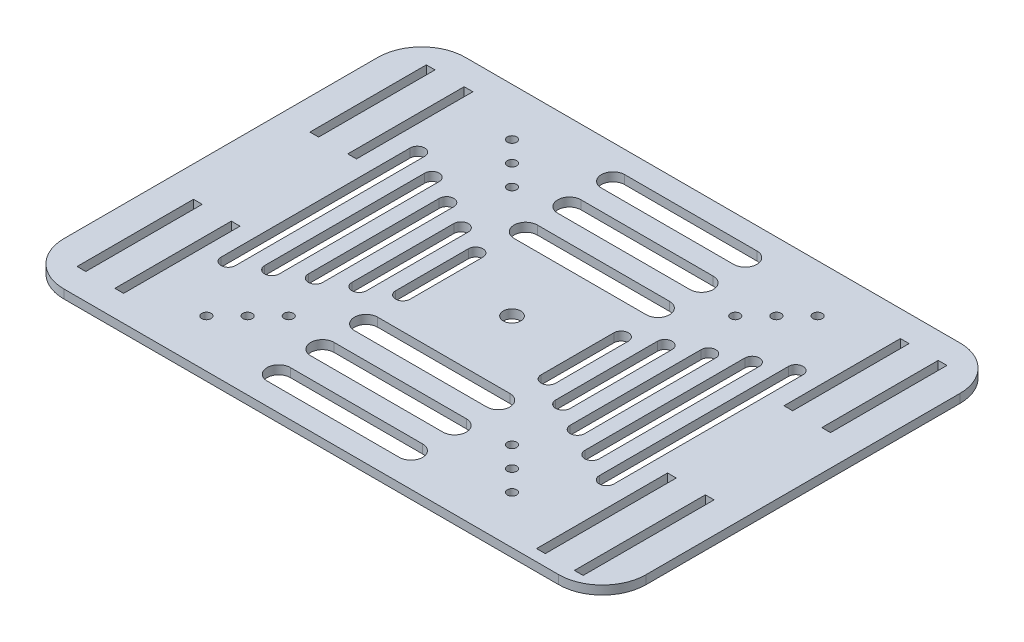
from build123d import *

# Parameters (mm, degrees)
SKETCH_2_R      = 1.6
SKETCH_2_W      = 3
SKETCH_2_H      = 40
SKETCH_2_H_2    = 45
SKETCH_2_R_2    = 3
EXTRUDE_1_DEPTH = 3
FILLET_1_R      = 15


with BuildPart() as part:
    # 草图2 → 凸台-拉伸1 (new body)
    with BuildSketch(Plane(origin=(0, 0, 0), x_dir=(1, 0, 0), z_dir=(0, 1, 0))):
        Polygon((100, -68.942911166), (100, 68.942911166), (-100, 68.942911166), (-100, -68.942911166), (0, -68.942911166), align=None)
        with Locations(Location((-52.5, -52.5, 0), (0, 0, 270))):
            Circle(SKETCH_2_R, mode=Mode.SUBTRACT)
        with Locations((-87.942911166, -40)):
            Rectangle(SKETCH_2_W, SKETCH_2_H, mode=Mode.SUBTRACT)
        with Locations((-74.942911166, -40)):
            Rectangle(SKETCH_2_W, SKETCH_2_H, mode=Mode.SUBTRACT)
        with Locations(Location((-45.428932188, -45.428932188, 0), (0, 0, 270))):
            Circle(SKETCH_2_R, mode=Mode.SUBTRACT)
        with Locations(Location((-38.357864376, -38.357864376, 0), (0, 0, 270))):
            Circle(SKETCH_2_R, mode=Mode.SUBTRACT)
        with BuildLine():
            ThreePointArc((22.714466094, -53.428932188), (26.714466094, -57.428932188), (22.714466094, -61.428932188))
            Line((22.714466094, -61.428932188), (-22.714466094, -61.428932188))
            ThreePointArc((-22.714466094, -61.428932188), (-26.714466094, -57.428932188), (-22.714466094, -53.428932188))
            Line((-22.714466094, -53.428932188), (22.714466094, -53.428932188))
        make_face(mode=Mode.SUBTRACT)
        with BuildLine():
            Line((22.714466094, -46.428932188), (-22.714466094, -46.428932188))
            ThreePointArc((-22.714466094, -46.428932188), (-26.714466094, -42.428932188), (-22.714466094, -38.428932188))
            Line((-22.714466094, -38.428932188), (22.714466094, -38.428932188))
            ThreePointArc((22.714466094, -38.428932188), (26.714466094, -42.428932188), (22.714466094, -46.428932188))
        make_face(mode=Mode.SUBTRACT)
        with Locations(Location((38.357864376, -38.357864376, 0), (0, 0, 270))):
            Circle(SKETCH_2_R, mode=Mode.SUBTRACT)
        with Locations(Location((52.5, -52.5, 0), (0, 0, 270))):
            Circle(SKETCH_2_R, mode=Mode.SUBTRACT)
        with Locations(Location((45.428932188, -45.428932188, 0), (0, 0, 270))):
            Circle(SKETCH_2_R, mode=Mode.SUBTRACT)
        with Locations((74.942911166, -42.5)):
            Rectangle(SKETCH_2_W, SKETCH_2_H_2, mode=Mode.SUBTRACT)
        with Locations((87.942911166, -42.5)):
            Rectangle(SKETCH_2_W, SKETCH_2_H_2, mode=Mode.SUBTRACT)
        with BuildLine():
            Line((22.714466094, -31.428932188), (-22.714466094, -31.428932188))
            ThreePointArc((-22.714466094, -31.428932188), (-26.714466094, -27.428932188), (-22.714466094, -23.428932188))
            Line((-22.714466094, -23.428932188), (22.714466094, -23.428932188))
            ThreePointArc((22.714466094, -23.428932188), (26.714466094, -27.428932188), (22.714466094, -31.428932188))
        make_face(mode=Mode.SUBTRACT)
        with BuildLine():
            ThreePointArc((-62.5, -32.5), (-65, -35), (-67.5, -32.5))
            Line((-67.5, -32.5), (-67.5, 32.5))
            ThreePointArc((-67.5, 32.5), (-65, 35), (-62.5, 32.5))
            Line((-62.5, 32.5), (-62.5, -32.5))
        make_face(mode=Mode.SUBTRACT)
        with BuildLine():
            ThreePointArc((-57.5, 27.5), (-55, 30), (-52.5, 27.5))
            Line((-52.5, 27.5), (-52.5, -27.5))
            ThreePointArc((-52.5, -27.5), (-55, -30), (-57.5, -27.5))
            Line((-57.5, -27.5), (-57.5, 27.5))
        make_face(mode=Mode.SUBTRACT)
        with BuildLine():
            Line((-47.5, -22.5), (-47.5, 22.5))
            ThreePointArc((-47.5, 22.5), (-45, 25), (-42.5, 22.5))
            Line((-42.5, 22.5), (-42.5, -22.5))
            ThreePointArc((-42.5, -22.5), (-45, -25), (-47.5, -22.5))
        make_face(mode=Mode.SUBTRACT)
        with BuildLine():
            Line((-37.5, -17.5), (-37.5, 17.5))
            ThreePointArc((-37.5, 17.5), (-35, 20), (-32.5, 17.5))
            Line((-32.5, 17.5), (-32.5, -17.5))
            ThreePointArc((-32.5, -17.5), (-35, -20), (-37.5, -17.5))
        make_face(mode=Mode.SUBTRACT)
        with BuildLine():
            Line((-27.5, -12.5), (-27.5, 12.5))
            ThreePointArc((-27.5, 12.5), (-25, 15), (-22.5, 12.5))
            Line((-22.5, 12.5), (-22.5, -12.5))
            ThreePointArc((-22.5, -12.5), (-25, -15), (-27.5, -12.5))
        make_face(mode=Mode.SUBTRACT)
        with Locations(Location((0, 0, 0), (0, 0, 270))):
            Circle(SKETCH_2_R_2, mode=Mode.SUBTRACT)
        with BuildLine():
            Line((22.714466094, 23.428932188), (-22.714466094, 23.428932188))
            ThreePointArc((-22.714466094, 23.428932188), (-26.714466094, 27.428932188), (-22.714466094, 31.428932188))
            Line((-22.714466094, 31.428932188), (22.714466094, 31.428932188))
            ThreePointArc((22.714466094, 31.428932188), (26.714466094, 27.428932188), (22.714466094, 23.428932188))
        make_face(mode=Mode.SUBTRACT)
        with Locations((-87.942911166, 40)):
            Rectangle(SKETCH_2_W, SKETCH_2_H, mode=Mode.SUBTRACT)
        with Locations((-74.942911166, 40)):
            Rectangle(SKETCH_2_W, SKETCH_2_H, mode=Mode.SUBTRACT)
        with Locations(Location((-45.428932188, 45.428932188, 0), (0, 0, 270))):
            Circle(SKETCH_2_R, mode=Mode.SUBTRACT)
        with Locations(Location((-52.5, 52.5, 0), (0, 0, 270))):
            Circle(SKETCH_2_R, mode=Mode.SUBTRACT)
        with Locations(Location((-38.357864376, 38.357864376, 0), (0, 0, 270))):
            Circle(SKETCH_2_R, mode=Mode.SUBTRACT)
        with BuildLine():
            ThreePointArc((-22.714466094, 38.428932188), (-26.456123481, 41.014718626), (-25.360217405, 45.428932188))
            ThreePointArc((-25.360217405, 45.428932188), (-24.128679656, 46.170589575), (-22.714466094, 46.428932188))
            Line((-22.714466094, 46.428932188), (22.714466094, 46.428932188))
            ThreePointArc((22.714466094, 46.428932188), (26.714466094, 42.428932188), (22.714466094, 38.428932188))
            Line((22.714466094, 38.428932188), (-22.714466094, 38.428932188))
        make_face(mode=Mode.SUBTRACT)
        with BuildLine():
            ThreePointArc((22.714466094, 61.428932188), (26.714466094, 57.428932188), (22.714466094, 53.428932188))
            Line((22.714466094, 53.428932188), (-22.714466094, 53.428932188))
            ThreePointArc((-22.714466094, 53.428932188), (-26.714466094, 57.428932188), (-22.714466094, 61.428932188))
            Line((-22.714466094, 61.428932188), (22.714466094, 61.428932188))
        make_face(mode=Mode.SUBTRACT)
        with BuildLine():
            Line((22.5, -12.5), (22.5, 12.5))
            ThreePointArc((22.5, 12.5), (25, 15), (27.5, 12.5))
            Line((27.5, 12.5), (27.5, -12.5))
            ThreePointArc((27.5, -12.5), (25, -15), (22.5, -12.5))
        make_face(mode=Mode.SUBTRACT)
        with BuildLine():
            Line((32.5, -17.5), (32.5, 17.5))
            ThreePointArc((32.5, 17.5), (35, 20), (37.5, 17.5))
            Line((37.5, 17.5), (37.5, -17.5))
            ThreePointArc((37.5, -17.5), (35, -20), (32.5, -17.5))
        make_face(mode=Mode.SUBTRACT)
        with BuildLine():
            Line((42.5, -22.5), (42.5, 22.5))
            ThreePointArc((42.5, 22.5), (45, 25), (47.5, 22.5))
            Line((47.5, 22.5), (47.5, -22.5))
            ThreePointArc((47.5, -22.5), (45, -25), (42.5, -22.5))
        make_face(mode=Mode.SUBTRACT)
        with BuildLine():
            Line((52.5, -27.5), (52.5, 27.5))
            ThreePointArc((52.5, 27.5), (55, 30), (57.5, 27.5))
            Line((57.5, 27.5), (57.5, -27.5))
            ThreePointArc((57.5, -27.5), (55, -30), (52.5, -27.5))
        make_face(mode=Mode.SUBTRACT)
        with BuildLine():
            Line((62.5, -32.5), (62.5, 32.5))
            ThreePointArc((62.5, 32.5), (65, 35), (67.5, 32.5))
            Line((67.5, 32.5), (67.5, -32.5))
            ThreePointArc((67.5, -32.5), (65, -35), (62.5, -32.5))
        make_face(mode=Mode.SUBTRACT)
        with Locations(Location((38.357864376, 38.357864376, 0), (0, 0, 270))):
            Circle(SKETCH_2_R, mode=Mode.SUBTRACT)
        with Locations(Location((45.428932188, 45.428932188, 0), (0, 0, 270))):
            Circle(SKETCH_2_R, mode=Mode.SUBTRACT)
        with Locations((74.942911166, 40)):
            Rectangle(SKETCH_2_W, SKETCH_2_H, mode=Mode.SUBTRACT)
        with Locations((87.942911166, 40)):
            Rectangle(SKETCH_2_W, SKETCH_2_H, mode=Mode.SUBTRACT)
        with Locations(Location((52.5, 52.5, 0), (0, 0, 270))):
            Circle(SKETCH_2_R, mode=Mode.SUBTRACT)
    extrude(amount=EXTRUDE_1_DEPTH)

    # 圆角1
    fillet_1_edges = [part.edges().sort_by_distance(p)[0] for p in [
        (-100, 1.5, -68.942911166),
        (100, 1.5, -68.942911166),
        (100, 1.5, 68.942911166),
        (-100, 1.5, 68.942911166),
    ]]
    fillet(fillet_1_edges, radius=FILLET_1_R)


solid = part.part
